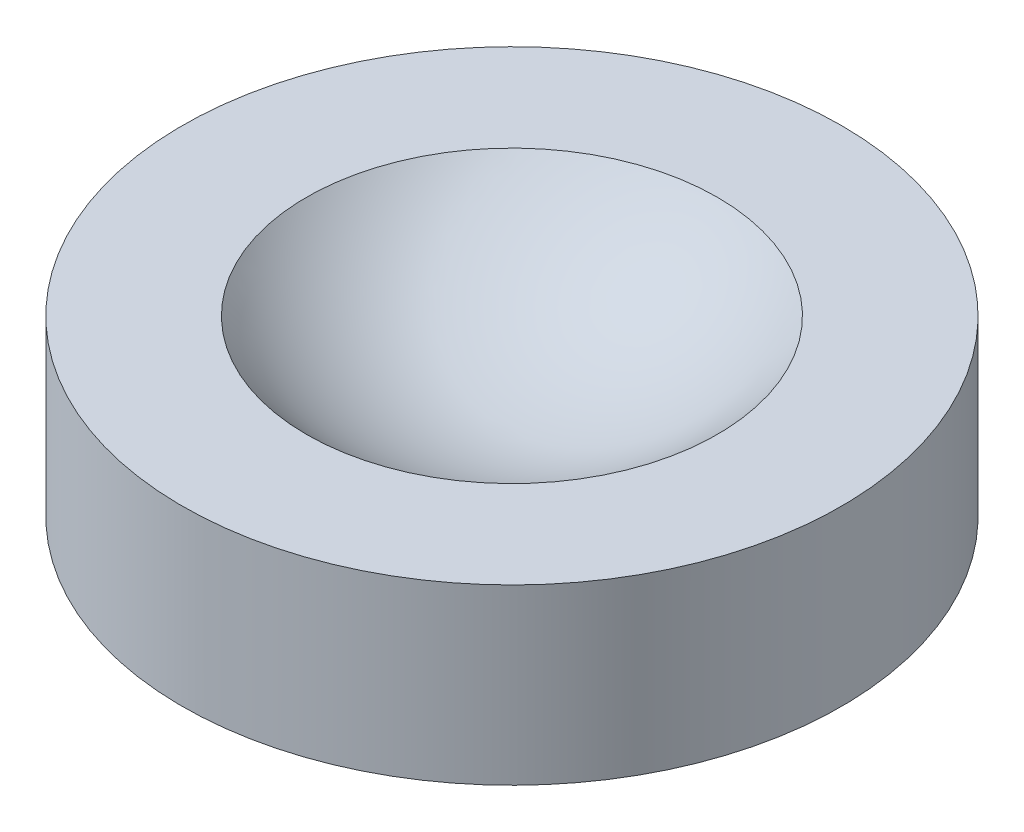
from build123d import *

# Parameters (mm, degrees)
KEYED_BACK_DEPTH   = 0.5
CUP_BLANK_SKETCH_R = 3.8
CUP_BLANK_DEPTH    = 1.5


with BuildPart() as part:
    # Keyed Back Sketch → Keyed Back (new body)
    with BuildSketch(Plane(origin=(0, -69, 0), x_dir=(-1, 0, 0), z_dir=(0, -1, 0))):
        with BuildLine():
            Line((74.811552234, 27.412647946), (70.771750258, 29.745028704))
            ThreePointArc((70.771750258, 29.745028704), (69.391651246, 22.689865579), (74.811552234, 27.412647946))
        make_face()
    extrude(amount=KEYED_BACK_DEPTH)

    # Cup Blank Sketch → Cup Blank (add)
    with BuildSketch(Plane(origin=(0, -69.5, 0), x_dir=(-1, 0, 0), z_dir=(0, -1, 0))):
        with Locations(Location((71.291651246, 25.980762114, 0), (0, 0, 22.136353638))):
            Circle(CUP_BLANK_SKETCH_R)
    extrude(amount=CUP_BLANK_DEPTH)

    # Spherical Bearing Seat profile → Spherical Bearing Seat (revolve, cut)
    with BuildSketch(Plane(origin=(0, -73, 0), x_dir=(-1, 0, 0), z_dir=(0, -1, 0))):
        with BuildLine():
            Line((71.291651246, 22.880762114), (71.291651246, 29.080762114))
            ThreePointArc((71.291651246, 29.080762114), (68.191651246, 25.980762114), (71.291651246, 22.880762114))
        make_face()
    revolve(axis=Axis((-71.291651246, -73, -35.980762114), (0, 0, 1)), mode=Mode.SUBTRACT)


with BuildPart() as body_2:
    # Mirror1: mirrored copy
    add(part.part.mirror(Plane(origin=(0, 0, 0), x_dir=(0, 0, 1), z_dir=(0, -1, 0))))


solid = body_2.part
